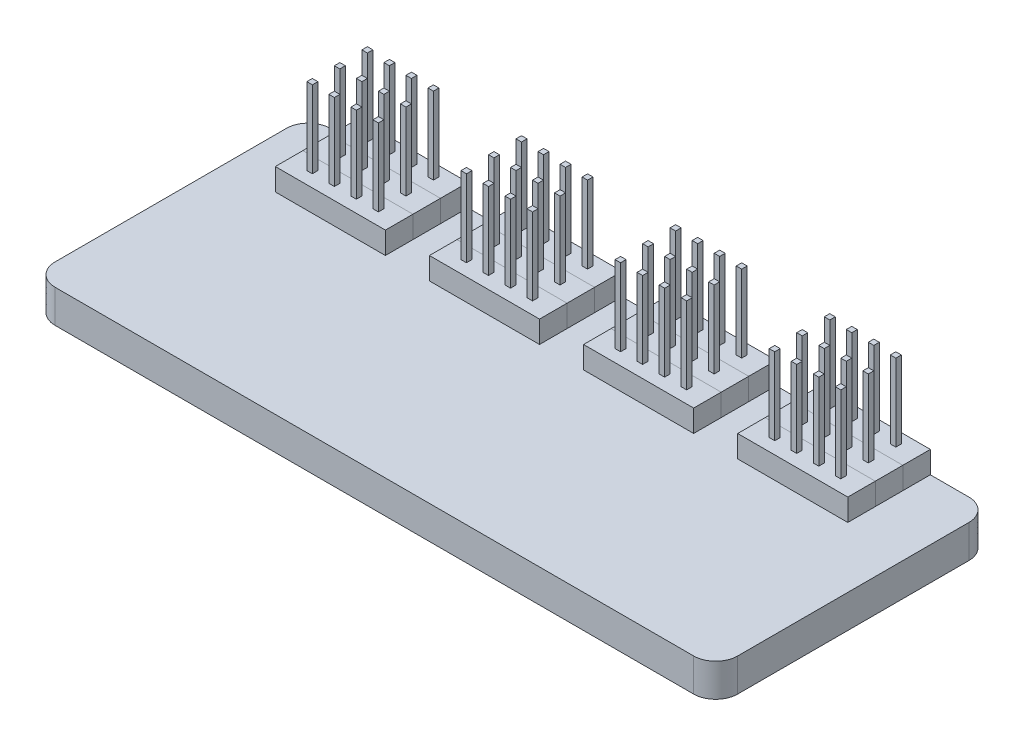
from build123d import *

# Parameters (mm, degrees)
EXTRUDE_1_DEPTH          = 3
SKETCH_3_W               = 10
SKETCH_3_H               = 2.5
EXTRUDE_2_DEPTH          = 2
SKETCH_4_W               = 0.5
SKETCH_4_H               = 0.5
EXTRUDE_3_DEPTH          = 7
EXTRUDE_3_2_DEPTH        = 7
EXTRUDE_3_3_DEPTH        = 7
EXTRUDE_3_4_DEPTH        = 7
PATTERN_LINEAR_1_COUNT   = 4
PATTERN_LINEAR_1_PITCH   = 14
PATTERN_LINEAR_1_2_COUNT = 3
PATTERN_LINEAR_1_2_PITCH = 2.5


with BuildPart() as part:
    # 스케치1 → 보스-돌출1 (new body)
    with BuildSketch(Plane(origin=(0, 0, 0), x_dir=(1, 0, 0), z_dir=(0, 1, 0))):
        with BuildLine():
            Line((-28.99999997, -12.5), (29.00000001, -12.5))
            add(Edge.make_bspline(
                [(29.00000001, -12.5), (29.065451542, -12.498156691), (29.196354594, -12.494470074), (29.390801229, -12.464475537), (29.581524641, -12.417051093), (29.82808538, -12.328687018), (30.118351944, -12.173668767), (30.423318817, -11.923314697), (30.673654461, -11.618353816), (30.828729144, -11.328082684), (30.916978145, -11.081529025), (30.959455701, -10.911938391), (30.98422766, -10.761244246), (30.997545734, -10.63090043), (30.999181352, -10.543664751), (31.00000004, -10.5)],
                knots=[0, 0, 0, 0, 0.062536112, 0.125072213, 0.187608306, 0.250144396, 0.375065218, 0.499986038, 0.624906843, 0.749827654, 0.812363756, 0.874899851, 0.916629791, 0.958270063, 1, 1, 1, 1], degree=3))
            Line((31.00000004, -10.5), (31.00000004, 10.5))
            add(Edge.make_bspline(
                [(31.00000004, 10.5), (30.998156731, 10.565451517), (30.994470112, 10.696354555), (30.964475559, 10.890801175), (30.91705114, 11.081524609), (30.828687049, 11.328085347), (30.67366882, 11.618351905), (30.423314749, 11.923318765), (30.118353855, 12.173654409), (29.828082717, 12.328729114), (29.581529057, 12.416978098), (29.411938446, 12.459455677), (29.261244298, 12.484227624), (29.130900468, 12.497545695), (29.043664772, 12.499181312), (29.00000001, 12.5)],
                knots=[0, 0, 0, 0, 0.062536098, 0.125072199, 0.187608294, 0.250144396, 0.375065208, 0.499986013, 0.624906833, 0.749827655, 0.812363744, 0.874899837, 0.916629776, 0.958270052, 1, 1, 1, 1], degree=3))
            Line((29.00000001, 12.5), (25.30000002, 12.5))
            Line((25.30000002, 12.5), (23.20000002, 12.5))
            Line((23.20000002, 12.5), (22.80000002, 12.5))
            Line((22.80000002, 12.5), (20.70000002, 12.5))
            Line((20.70000002, 12.5), (20.30000002, 12.5))
            Line((20.30000002, 12.5), (18.20000002, 12.5))
            Line((18.20000002, 12.5), (17.80000002, 12.5))
            Line((17.80000002, 12.5), (15.70000002, 12.5))
            Line((15.70000002, 12.5), (12.80000002, 12.5))
            Line((12.80000002, 12.5), (10.70000002, 12.5))
            Line((10.70000002, 12.5), (10.30000002, 12.5))
            Line((10.30000002, 12.5), (8.20000002, 12.5))
            Line((8.20000002, 12.5), (7.80000002, 12.5))
            Line((7.80000002, 12.5), (5.70000002, 12.5))
            Line((5.70000002, 12.5), (5.30000002, 12.5))
            Line((5.30000002, 12.5), (3.20000002, 12.5))
            Line((3.20000002, 12.5), (-3.19999998, 12.5))
            Line((-3.19999998, 12.5), (-5.29999998, 12.5))
            Line((-5.29999998, 12.5), (-5.69999998, 12.5))
            Line((-5.69999998, 12.5), (-7.79999998, 12.5))
            Line((-7.79999998, 12.5), (-8.19999998, 12.5))
            Line((-8.19999998, 12.5), (-10.29999998, 12.5))
            Line((-10.29999998, 12.5), (-10.69999998, 12.5))
            Line((-10.69999998, 12.5), (-12.79999998, 12.5))
            Line((-12.79999998, 12.5), (-15.69999998, 12.5))
            Line((-15.69999998, 12.5), (-17.79999998, 12.5))
            Line((-17.79999998, 12.5), (-18.19999998, 12.5))
            Line((-18.19999998, 12.5), (-20.29999998, 12.5))
            Line((-20.29999998, 12.5), (-20.69999998, 12.5))
            Line((-20.69999998, 12.5), (-22.79999998, 12.5))
            Line((-22.79999998, 12.5), (-23.19999998, 12.5))
            Line((-23.19999998, 12.5), (-25.29999998, 12.5))
            Line((-25.29999998, 12.5), (-28.99999997, 12.5))
            add(Edge.make_bspline(
                [(-28.99999997, 12.5), (-29.065451502, 12.498156692), (-29.196354554, 12.494470074), (-29.390801189, 12.464475537), (-29.581524601, 12.417051093), (-29.82808534, 12.328687019), (-30.118351904, 12.173668768), (-30.423318776, 11.923314697), (-30.673654421, 11.618353816), (-30.828729104, 11.328082684), (-30.916978105, 11.081529025), (-30.959455661, 10.911938391), (-30.98422762, 10.761244247), (-30.997545693, 10.630900431), (-30.999181311, 10.543664751), (-31, 10.5)],
                knots=[0, 0, 0, 0, 0.062536112, 0.125072213, 0.187608306, 0.250144396, 0.375065218, 0.499986038, 0.624906843, 0.749827654, 0.812363756, 0.874899851, 0.916629791, 0.958270063, 1, 1, 1, 1], degree=3))
            Line((-31, 10.5), (-31, -10.5))
            add(Edge.make_bspline(
                [(-31, -10.5), (-30.998156691, -10.565451517), (-30.994470072, -10.696354555), (-30.964475519, -10.890801175), (-30.9170511, -11.081524608), (-30.828687009, -11.328085346), (-30.67366878, -11.618351905), (-30.423314709, -11.923318764), (-30.118353815, -12.173654408), (-29.828082677, -12.328729113), (-29.581529017, -12.416978098), (-29.411938406, -12.459455676), (-29.261244258, -12.484227624), (-29.130900428, -12.497545695), (-29.043664732, -12.499181312), (-28.99999997, -12.5)],
                knots=[0, 0, 0, 0, 0.062536098, 0.125072199, 0.187608294, 0.250144396, 0.375065208, 0.499986013, 0.624906833, 0.749827655, 0.812363744, 0.874899837, 0.916629776, 0.958270052, 1, 1, 1, 1], degree=3))
        make_face()
    extrude(amount=EXTRUDE_1_DEPTH)


with BuildPart() as body_2:
    # 스케치3 → 보스-돌출2 (new body)
    with BuildSketch(Plane(origin=(0, 3, 0), x_dir=(1, 0, 0), z_dir=(0, 1, 0))):
        with Locations((20.50000004, 11.25)):
            Rectangle(SKETCH_3_W, SKETCH_3_H)
    extrude(amount=EXTRUDE_2_DEPTH)


with BuildPart() as body_3:
    # 스케치4 → 보스-돌출3 (new body)
    with BuildSketch(Plane(origin=(0, 5, 0), x_dir=(1, 0, 0), z_dir=(0, 1, 0))):
        with Locations((19.503294518, 11.3603522)):
            Rectangle(SKETCH_4_W, SKETCH_4_H)
    extrude(amount=EXTRUDE_3_DEPTH)


with BuildPart() as body_4:
    # 스케치4 → Extrude 3 2 (new body)
    with BuildSketch(Plane(origin=(0, 5, 0), x_dir=(1, 0, 0), z_dir=(0, 1, 0))):
        with Locations((17.503294518, 11.3603522)):
            Rectangle(SKETCH_4_W, SKETCH_4_H)
    extrude(amount=EXTRUDE_3_2_DEPTH)


with BuildPart() as body_5:
    # 스케치4 → Extrude 3 3 (new body)
    with BuildSketch(Plane(origin=(0, 5, 0), x_dir=(1, 0, 0), z_dir=(0, 1, 0))):
        with Locations((21.503294518, 11.3603522)):
            Rectangle(SKETCH_4_W, SKETCH_4_H)
    extrude(amount=EXTRUDE_3_3_DEPTH)


with BuildPart() as body_6:
    # 스케치4 → Extrude 3 4 (new body)
    with BuildSketch(Plane(origin=(0, 5, 0), x_dir=(1, 0, 0), z_dir=(0, 1, 0))):
        with Locations((23.503294518, 11.3603522)):
            Rectangle(SKETCH_4_W, SKETCH_4_H)
    extrude(amount=EXTRUDE_3_4_DEPTH)


with BuildPart() as pattern_linear_1_1:
    # 선형 패턴1: pattern copy
    add(body_6.part.moved(Location(Vector(-1, 0, 0) * (1 * PATTERN_LINEAR_1_PITCH))))


with BuildPart() as pattern_linear_1_2:
    # 선형 패턴1: pattern copy
    add(body_6.part.moved(Location(Vector(-1, 0, 0) * (2 * PATTERN_LINEAR_1_PITCH))))


with BuildPart() as pattern_linear_1_3:
    # 선형 패턴1: pattern copy
    add(body_6.part.moved(Location(Vector(-1, 0, 0) * (3 * PATTERN_LINEAR_1_PITCH))))


with BuildPart() as pattern_linear_1_4:
    # 선형 패턴1: pattern copy
    add(body_5.part.moved(Location(Vector(-1, 0, 0) * (1 * PATTERN_LINEAR_1_PITCH))))


with BuildPart() as pattern_linear_1_5:
    # 선형 패턴1: pattern copy
    add(body_5.part.moved(Location(Vector(-1, 0, 0) * (2 * PATTERN_LINEAR_1_PITCH))))


with BuildPart() as pattern_linear_1_6:
    # 선형 패턴1: pattern copy
    add(body_5.part.moved(Location(Vector(-1, 0, 0) * (3 * PATTERN_LINEAR_1_PITCH))))


with BuildPart() as pattern_linear_1_7:
    # 선형 패턴1: pattern copy
    add(body_3.part.moved(Location(Vector(-1, 0, 0) * (1 * PATTERN_LINEAR_1_PITCH))))


with BuildPart() as pattern_linear_1_8:
    # 선형 패턴1: pattern copy
    add(body_3.part.moved(Location(Vector(-1, 0, 0) * (2 * PATTERN_LINEAR_1_PITCH))))


with BuildPart() as pattern_linear_1_9:
    # 선형 패턴1: pattern copy
    add(body_3.part.moved(Location(Vector(-1, 0, 0) * (3 * PATTERN_LINEAR_1_PITCH))))


with BuildPart() as pattern_linear_1_10:
    # 선형 패턴1: pattern copy
    add(body_4.part.moved(Location(Vector(-1, 0, 0) * (1 * PATTERN_LINEAR_1_PITCH))))


with BuildPart() as pattern_linear_1_11:
    # 선형 패턴1: pattern copy
    add(body_4.part.moved(Location(Vector(-1, 0, 0) * (2 * PATTERN_LINEAR_1_PITCH))))


with BuildPart() as pattern_linear_1_12:
    # 선형 패턴1: pattern copy
    add(body_4.part.moved(Location(Vector(-1, 0, 0) * (3 * PATTERN_LINEAR_1_PITCH))))


with BuildPart() as pattern_linear_1_13:
    # 선형 패턴1: pattern copy
    add(body_2.part.moved(Location(Vector(-1, 0, 0) * (1 * PATTERN_LINEAR_1_PITCH))))


with BuildPart() as pattern_linear_1_14:
    # 선형 패턴1: pattern copy
    add(body_2.part.moved(Location(Vector(-1, 0, 0) * (2 * PATTERN_LINEAR_1_PITCH))))


with BuildPart() as pattern_linear_1_15:
    # 선형 패턴1: pattern copy
    add(body_2.part.moved(Location(Vector(-1, 0, 0) * (3 * PATTERN_LINEAR_1_PITCH))))


with BuildPart() as pattern_linear_1_2_1:
    # Pattern Linear 1 2: pattern copy
    add(body_6.part.moved(Location(Vector(0, 0, 1) * (1 * PATTERN_LINEAR_1_2_PITCH))))


with BuildPart() as pattern_linear_1_2_2:
    # Pattern Linear 1 2: pattern copy
    add(body_6.part.moved(Location(Vector(0, 0, 1) * (2 * PATTERN_LINEAR_1_2_PITCH))))


with BuildPart() as pattern_linear_1_2_3:
    # Pattern Linear 1 2: pattern copy
    add(body_5.part.moved(Location(Vector(0, 0, 1) * (1 * PATTERN_LINEAR_1_2_PITCH))))


with BuildPart() as pattern_linear_1_2_4:
    # Pattern Linear 1 2: pattern copy
    add(body_5.part.moved(Location(Vector(0, 0, 1) * (2 * PATTERN_LINEAR_1_2_PITCH))))


with BuildPart() as pattern_linear_1_2_5:
    # Pattern Linear 1 2: pattern copy
    add(body_3.part.moved(Location(Vector(0, 0, 1) * (1 * PATTERN_LINEAR_1_2_PITCH))))


with BuildPart() as pattern_linear_1_2_6:
    # Pattern Linear 1 2: pattern copy
    add(body_3.part.moved(Location(Vector(0, 0, 1) * (2 * PATTERN_LINEAR_1_2_PITCH))))


with BuildPart() as pattern_linear_1_2_7:
    # Pattern Linear 1 2: pattern copy
    add(body_4.part.moved(Location(Vector(0, 0, 1) * (1 * PATTERN_LINEAR_1_2_PITCH))))


with BuildPart() as pattern_linear_1_2_8:
    # Pattern Linear 1 2: pattern copy
    add(body_4.part.moved(Location(Vector(0, 0, 1) * (2 * PATTERN_LINEAR_1_2_PITCH))))


with BuildPart() as pattern_linear_1_2_9:
    # Pattern Linear 1 2: pattern copy
    add(body_2.part.moved(Location(Vector(0, 0, 1) * (1 * PATTERN_LINEAR_1_2_PITCH))))


with BuildPart() as pattern_linear_1_2_10:
    # Pattern Linear 1 2: pattern copy
    add(body_2.part.moved(Location(Vector(0, 0, 1) * (2 * PATTERN_LINEAR_1_2_PITCH))))


with BuildPart() as pattern_linear_1_2_11:
    # Pattern Linear 1 2: pattern copy
    add(pattern_linear_1_1.part.moved(Location(Vector(0, 0, 1) * (1 * PATTERN_LINEAR_1_2_PITCH))))


with BuildPart() as pattern_linear_1_2_12:
    # Pattern Linear 1 2: pattern copy
    add(pattern_linear_1_1.part.moved(Location(Vector(0, 0, 1) * (2 * PATTERN_LINEAR_1_2_PITCH))))


with BuildPart() as pattern_linear_1_2_13:
    # Pattern Linear 1 2: pattern copy
    add(pattern_linear_1_2.part.moved(Location(Vector(0, 0, 1) * (1 * PATTERN_LINEAR_1_2_PITCH))))


with BuildPart() as pattern_linear_1_2_14:
    # Pattern Linear 1 2: pattern copy
    add(pattern_linear_1_2.part.moved(Location(Vector(0, 0, 1) * (2 * PATTERN_LINEAR_1_2_PITCH))))


with BuildPart() as pattern_linear_1_2_15:
    # Pattern Linear 1 2: pattern copy
    add(pattern_linear_1_3.part.moved(Location(Vector(0, 0, 1) * (1 * PATTERN_LINEAR_1_2_PITCH))))


with BuildPart() as pattern_linear_1_2_16:
    # Pattern Linear 1 2: pattern copy
    add(pattern_linear_1_3.part.moved(Location(Vector(0, 0, 1) * (2 * PATTERN_LINEAR_1_2_PITCH))))


with BuildPart() as pattern_linear_1_2_17:
    # Pattern Linear 1 2: pattern copy
    add(pattern_linear_1_4.part.moved(Location(Vector(0, 0, 1) * (1 * PATTERN_LINEAR_1_2_PITCH))))


with BuildPart() as pattern_linear_1_2_18:
    # Pattern Linear 1 2: pattern copy
    add(pattern_linear_1_4.part.moved(Location(Vector(0, 0, 1) * (2 * PATTERN_LINEAR_1_2_PITCH))))


with BuildPart() as pattern_linear_1_2_19:
    # Pattern Linear 1 2: pattern copy
    add(pattern_linear_1_5.part.moved(Location(Vector(0, 0, 1) * (1 * PATTERN_LINEAR_1_2_PITCH))))


with BuildPart() as pattern_linear_1_2_20:
    # Pattern Linear 1 2: pattern copy
    add(pattern_linear_1_5.part.moved(Location(Vector(0, 0, 1) * (2 * PATTERN_LINEAR_1_2_PITCH))))


with BuildPart() as pattern_linear_1_2_21:
    # Pattern Linear 1 2: pattern copy
    add(pattern_linear_1_6.part.moved(Location(Vector(0, 0, 1) * (1 * PATTERN_LINEAR_1_2_PITCH))))


with BuildPart() as pattern_linear_1_2_22:
    # Pattern Linear 1 2: pattern copy
    add(pattern_linear_1_6.part.moved(Location(Vector(0, 0, 1) * (2 * PATTERN_LINEAR_1_2_PITCH))))


with BuildPart() as pattern_linear_1_2_23:
    # Pattern Linear 1 2: pattern copy
    add(pattern_linear_1_7.part.moved(Location(Vector(0, 0, 1) * (1 * PATTERN_LINEAR_1_2_PITCH))))


with BuildPart() as pattern_linear_1_2_24:
    # Pattern Linear 1 2: pattern copy
    add(pattern_linear_1_7.part.moved(Location(Vector(0, 0, 1) * (2 * PATTERN_LINEAR_1_2_PITCH))))


with BuildPart() as pattern_linear_1_2_25:
    # Pattern Linear 1 2: pattern copy
    add(pattern_linear_1_8.part.moved(Location(Vector(0, 0, 1) * (1 * PATTERN_LINEAR_1_2_PITCH))))


with BuildPart() as pattern_linear_1_2_26:
    # Pattern Linear 1 2: pattern copy
    add(pattern_linear_1_8.part.moved(Location(Vector(0, 0, 1) * (2 * PATTERN_LINEAR_1_2_PITCH))))


with BuildPart() as pattern_linear_1_2_27:
    # Pattern Linear 1 2: pattern copy
    add(pattern_linear_1_9.part.moved(Location(Vector(0, 0, 1) * (1 * PATTERN_LINEAR_1_2_PITCH))))


with BuildPart() as pattern_linear_1_2_28:
    # Pattern Linear 1 2: pattern copy
    add(pattern_linear_1_9.part.moved(Location(Vector(0, 0, 1) * (2 * PATTERN_LINEAR_1_2_PITCH))))


with BuildPart() as pattern_linear_1_2_29:
    # Pattern Linear 1 2: pattern copy
    add(pattern_linear_1_10.part.moved(Location(Vector(0, 0, 1) * (1 * PATTERN_LINEAR_1_2_PITCH))))


with BuildPart() as pattern_linear_1_2_30:
    # Pattern Linear 1 2: pattern copy
    add(pattern_linear_1_10.part.moved(Location(Vector(0, 0, 1) * (2 * PATTERN_LINEAR_1_2_PITCH))))


with BuildPart() as pattern_linear_1_2_31:
    # Pattern Linear 1 2: pattern copy
    add(pattern_linear_1_11.part.moved(Location(Vector(0, 0, 1) * (1 * PATTERN_LINEAR_1_2_PITCH))))


with BuildPart() as pattern_linear_1_2_32:
    # Pattern Linear 1 2: pattern copy
    add(pattern_linear_1_11.part.moved(Location(Vector(0, 0, 1) * (2 * PATTERN_LINEAR_1_2_PITCH))))


with BuildPart() as pattern_linear_1_2_33:
    # Pattern Linear 1 2: pattern copy
    add(pattern_linear_1_12.part.moved(Location(Vector(0, 0, 1) * (1 * PATTERN_LINEAR_1_2_PITCH))))


with BuildPart() as pattern_linear_1_2_34:
    # Pattern Linear 1 2: pattern copy
    add(pattern_linear_1_12.part.moved(Location(Vector(0, 0, 1) * (2 * PATTERN_LINEAR_1_2_PITCH))))


with BuildPart() as pattern_linear_1_2_35:
    # Pattern Linear 1 2: pattern copy
    add(pattern_linear_1_13.part.moved(Location(Vector(0, 0, 1) * (1 * PATTERN_LINEAR_1_2_PITCH))))


with BuildPart() as pattern_linear_1_2_36:
    # Pattern Linear 1 2: pattern copy
    add(pattern_linear_1_13.part.moved(Location(Vector(0, 0, 1) * (2 * PATTERN_LINEAR_1_2_PITCH))))


with BuildPart() as pattern_linear_1_2_37:
    # Pattern Linear 1 2: pattern copy
    add(pattern_linear_1_14.part.moved(Location(Vector(0, 0, 1) * (1 * PATTERN_LINEAR_1_2_PITCH))))


with BuildPart() as pattern_linear_1_2_38:
    # Pattern Linear 1 2: pattern copy
    add(pattern_linear_1_14.part.moved(Location(Vector(0, 0, 1) * (2 * PATTERN_LINEAR_1_2_PITCH))))


with BuildPart() as pattern_linear_1_2_39:
    # Pattern Linear 1 2: pattern copy
    add(pattern_linear_1_15.part.moved(Location(Vector(0, 0, 1) * (1 * PATTERN_LINEAR_1_2_PITCH))))


with BuildPart() as pattern_linear_1_2_40:
    # Pattern Linear 1 2: pattern copy
    add(pattern_linear_1_15.part.moved(Location(Vector(0, 0, 1) * (2 * PATTERN_LINEAR_1_2_PITCH))))


solid = Compound([part.part, body_2.part, body_3.part, body_4.part, body_5.part, body_6.part, pattern_linear_1_1.part, pattern_linear_1_2.part, pattern_linear_1_3.part, pattern_linear_1_4.part, pattern_linear_1_5.part, pattern_linear_1_6.part, pattern_linear_1_7.part, pattern_linear_1_8.part, pattern_linear_1_9.part, pattern_linear_1_10.part, pattern_linear_1_11.part, pattern_linear_1_12.part, pattern_linear_1_13.part, pattern_linear_1_14.part, pattern_linear_1_15.part, pattern_linear_1_2_1.part, pattern_linear_1_2_2.part, pattern_linear_1_2_3.part, pattern_linear_1_2_4.part, pattern_linear_1_2_5.part, pattern_linear_1_2_6.part, pattern_linear_1_2_7.part, pattern_linear_1_2_8.part, pattern_linear_1_2_9.part, pattern_linear_1_2_10.part, pattern_linear_1_2_11.part, pattern_linear_1_2_12.part, pattern_linear_1_2_13.part, pattern_linear_1_2_14.part, pattern_linear_1_2_15.part, pattern_linear_1_2_16.part, pattern_linear_1_2_17.part, pattern_linear_1_2_18.part, pattern_linear_1_2_19.part, pattern_linear_1_2_20.part, pattern_linear_1_2_21.part, pattern_linear_1_2_22.part, pattern_linear_1_2_23.part, pattern_linear_1_2_24.part, pattern_linear_1_2_25.part, pattern_linear_1_2_26.part, pattern_linear_1_2_27.part, pattern_linear_1_2_28.part, pattern_linear_1_2_29.part, pattern_linear_1_2_30.part, pattern_linear_1_2_31.part, pattern_linear_1_2_32.part, pattern_linear_1_2_33.part, pattern_linear_1_2_34.part, pattern_linear_1_2_35.part, pattern_linear_1_2_36.part, pattern_linear_1_2_37.part, pattern_linear_1_2_38.part, pattern_linear_1_2_39.part, pattern_linear_1_2_40.part])
